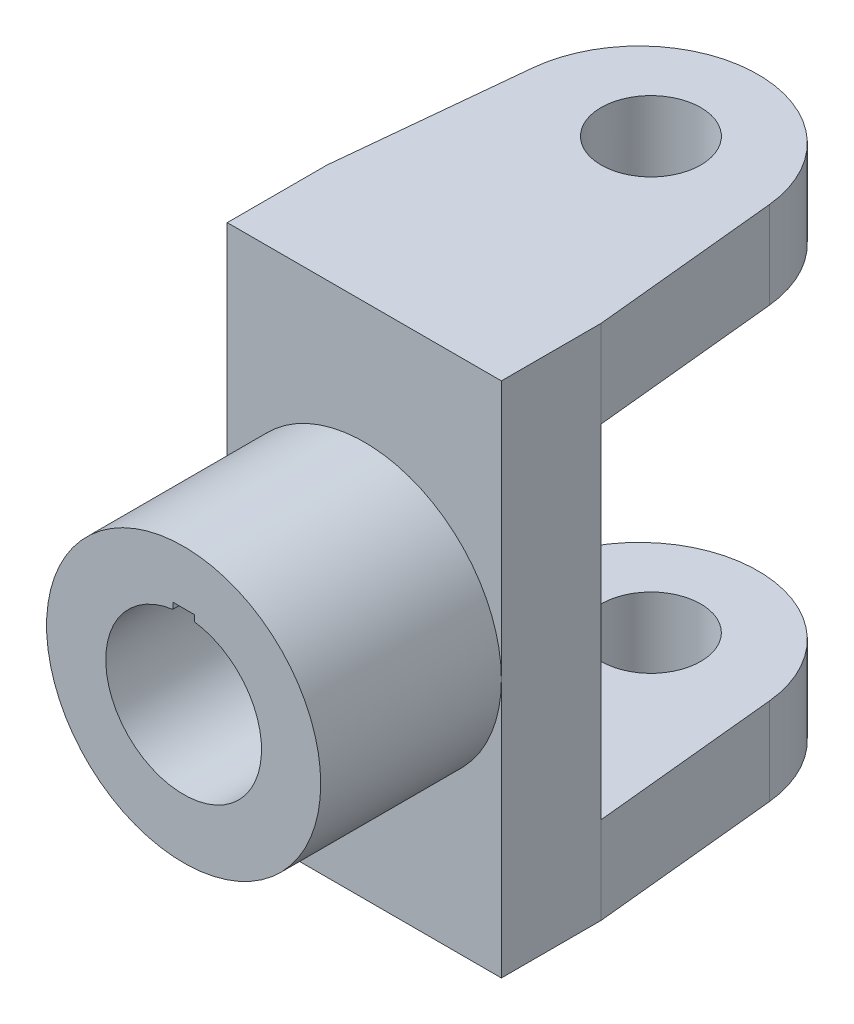
from build123d import *

# Parameters (mm, degrees)
SKETCH2_W           = 88
SKETCH2_H           = 32
SKETCH2_R           = 16
BOSS_EXTRUDE2_DEPTH = 166
SKETCH5_W           = 94.38952736
SKETCH5_H           = 110
CUT_EXTRUDE1_DEPTH  = 166
SKETCH6_R           = 44
BOSS_EXTRUDE4_DEPTH = 58


with BuildPart() as part:
    # Sketch2 → Boss-Extrude2 (new body)
    # profile 1 of 2: a face of its own
    with BuildSketch(Plane(origin=(0, 0, 0), x_dir=(1, 0, 0), z_dir=(0, 1, 0))):
        with Locations((44, 16)):
            Rectangle(SKETCH2_W, SKETCH2_H)
    # profile 2 of 2: a face of its own
    with BuildSketch(Plane(origin=(0, 0, 0), x_dir=(1, 0, 0), z_dir=(0, 1, 0))):
        with BuildLine():
            ThreePointArc((6, 92), (44, 126.38952736), (82, 92))
            Line((82, 92), (88, 32))
            Line((88, 32), (0, 32))
            Line((0, 32), (6, 92))
        make_face()
        with Locations(Location((44, 92, 0), (0, 0, 270))):
            Circle(SKETCH2_R, mode=Mode.SUBTRACT)
    extrude(amount=BOSS_EXTRUDE2_DEPTH)

    # Sketch5 → Cut-Extrude1 (cut)
    with BuildSketch(Plane(origin=(0, 0, 0), x_dir=(0, 0, -1), z_dir=(1, 0, 0))):
        with Locations((79.19476368, 83)):
            Rectangle(SKETCH5_W, SKETCH5_H)
    extrude(amount=CUT_EXTRUDE1_DEPTH, mode=Mode.SUBTRACT)

    # Sketch6 → Boss-Extrude4 (add)
    with BuildSketch(Plane.XY):
        with Locations((44, 83)):
            Circle(SKETCH6_R)
        with BuildLine():
            Line((40.50858553, 107.755), (40.50858553, 109.755))
            Line((40.50858553, 109.755), (47.50858553, 109.755))
            Line((47.50858553, 109.755), (47.50858553, 107.752572141))
            ThreePointArc((47.50858553, 107.752572141), (43.991329074, 58.000001504), (40.50858553, 107.755))
        make_face(mode=Mode.SUBTRACT)
    extrude(amount=BOSS_EXTRUDE4_DEPTH)


solid = part.part
